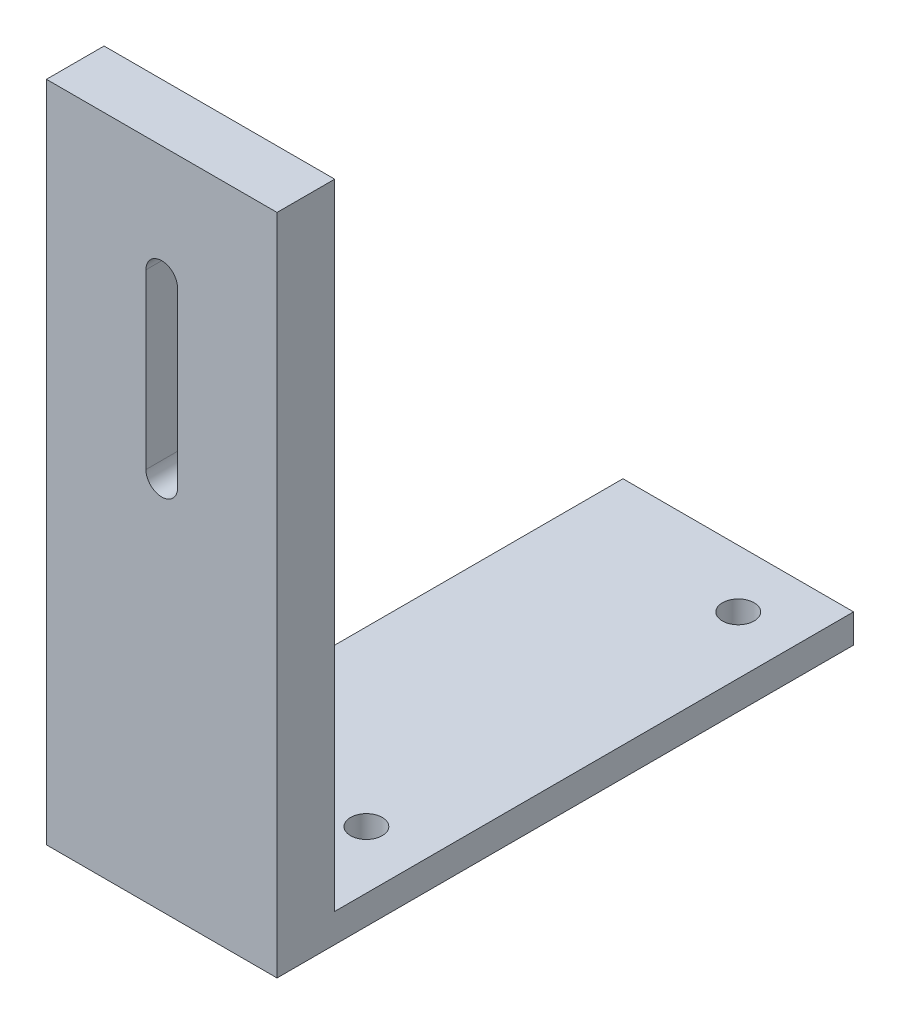
from build123d import *

# Parameters (mm, degrees)
SKETCH_1_W          = 40
SKETCH_1_H          = 5
EXTRUDE_1_DEPTH     = 100
SKETCH_3_R          = 2.75
CUT_EXTRUDE_1_DEPTH = 103.745450916
SKETCH_5_W          = 40
SKETCH_5_H          = 10
EXTRUDE_2_DEPTH     = 110
CUT_EXTRUDE_2_DEPTH = 148.839871767


with BuildPart() as part:
    # 草圖1 → 填料-伸長1 (new body)
    with BuildSketch(Plane.XY):
        with Locations((-3.057052805, 2.5)):
            Rectangle(SKETCH_1_W, SKETCH_1_H)
    extrude(amount=EXTRUDE_1_DEPTH)

    # 草圖3 → 除料-伸長1 (cut, through all)
    with BuildSketch(Plane(origin=(0, 5, 0), x_dir=(1, 0, 0), z_dir=(0, 1, 0))):
        with Locations(Location((6.942947195, -10, 0), (0, 0, 270))):
            Circle(SKETCH_3_R)
        with Locations(Location((6.942947195, -74.5, 0), (0, 0, 270))):
            Circle(SKETCH_3_R)
    extrude(amount=-CUT_EXTRUDE_1_DEPTH, mode=Mode.SUBTRACT)

    # 草圖5 → 填料-伸長2 (add)
    with BuildSketch(Plane(origin=(0, 5, 0), x_dir=(1, 0, 0), z_dir=(0, 1, 0))):
        with Locations((-3.057052805, -95)):
            Rectangle(SKETCH_5_W, SKETCH_5_H)
    extrude(amount=EXTRUDE_2_DEPTH)

    # 草圖7 → 除料-伸長2 (cut, through all)
    with BuildSketch(Plane(origin=(0, 0, 90), x_dir=(-1, 0, 0), z_dir=(0, 0, -1))):
        with BuildLine():
            Line((5.807052805, 95), (5.807052805, 65))
            ThreePointArc((5.807052805, 65), (3.057052805, 62.25), (0.307052805, 65))
            Line((0.307052805, 65), (0.307052805, 95))
            ThreePointArc((0.307052805, 95), (3.057052805, 97.75), (5.807052805, 95))
        make_face()
    extrude(amount=-CUT_EXTRUDE_2_DEPTH, mode=Mode.SUBTRACT)


solid = part.part
